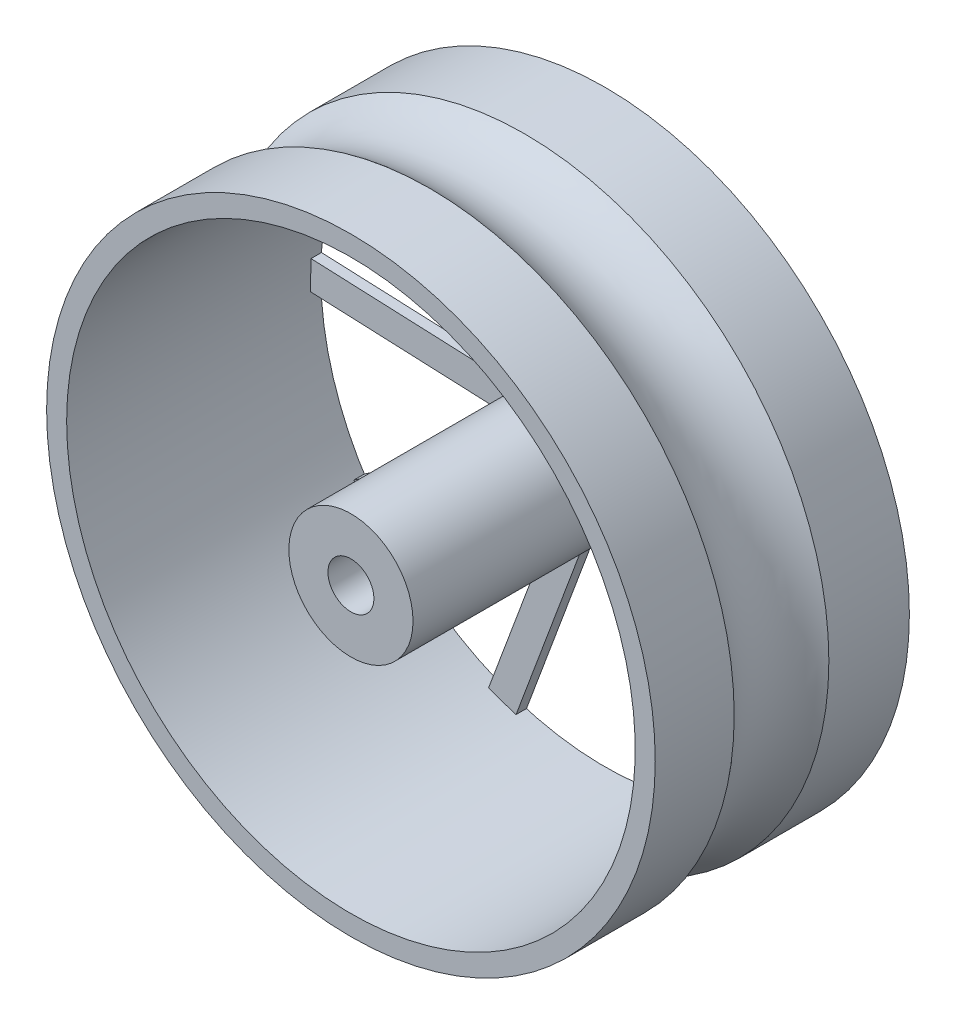
from build123d import *

# Parameters (mm, degrees)
SKETCH1_R             = 13.3223
SKETCH1_R_2           = 12.446
BOSS_EXTRUDE1_DEPTH   = 11.1252
SKETCH1_R_3           = 2.7178
SKETCH1_R_4           = 1.00584
BOSS_EXTRUDE1_2_DEPTH = 11.1252
BOSS_EXTRUDE2_DEPTH   = 0.4572
SKETCH5_R             = 3.187289882


with BuildPart() as part:
    # Sketch1 → Boss-Extrude1 (new body)
    with BuildSketch(Plane.XY):
        with Locations(Location((0, 0, 0), (0, 0, 180))):
            Circle(SKETCH1_R)
        with Locations(Location((0, 0, 0), (0, 0, 180))):
            Circle(SKETCH1_R_2, mode=Mode.SUBTRACT)
    extrude(amount=BOSS_EXTRUDE1_DEPTH)

    # Sketch5 → Cut-Revolve1 (revolve, cut)
    with BuildSketch(Plane(origin=(0, 0, 0), x_dir=(0, 0, -1), z_dir=(1, 0, 0)), mode=Mode.PRIVATE) as cut_revolve1_sk:
        with Locations((-5.597195997, 15.744244979)):
            Circle(SKETCH5_R)
    revolve(cut_revolve1_sk.sketch.rotate(Axis((0, 0, 11.606286755), (0, 0, -1)), 270), axis=Axis((0, 0, 11.606286755), (0, 0, -1)), mode=Mode.SUBTRACT)


with BuildPart() as body_2:
    # Sketch1 → Boss-Extrude1 2 (new body)
    with BuildSketch(Plane.XY):
        with Locations(Location((0, 0, 0), (0, 0, 180))):
            Circle(SKETCH1_R_3)
        with Locations(Location((0, 0, 0), (0, 0, 180))):
            Circle(SKETCH1_R_4, mode=Mode.SUBTRACT)
    extrude(amount=BOSS_EXTRUDE1_2_DEPTH)

    # Sketch2 → Boss-Extrude2 (add)
    with BuildSketch(Plane(origin=(0, 0, 0), x_dir=(-1, 0, 0), z_dir=(0, 0, -1))):
        with BuildLine():
            Line((0, 2.7178), (-3.442415798, 11.960463598))
            Line((-3.442415798, 11.960463598), (-4.643735623, 11.54723497))
            Line((-4.643735623, 11.54723497), (-1.243130148, 2.416829385))
            ThreePointArc((-1.243130148, 2.416829385), (-0.639522454, 2.641485921), (0, 2.7178))
        make_face()
        with BuildLine():
            ThreePointArc((-2.426290086, 1.224562477), (-2.070011002, 1.761105133), (-1.597482759, 2.198746387))
            Line((-1.597482759, 2.198746387), (-9.815156996, 7.652817073))
            Line((-9.815156996, 7.652817073), (-10.544155457, 6.612390014))
            Line((-10.544155457, 6.612390014), (-2.426290086, 1.224562477))
        make_face()
        with BuildLine():
            ThreePointArc((-2.682689677, -0.435445676), (-2.709825704, 0.208042043), (-2.5847814, 0.839846387))
            Line((-2.5847814, 0.839846387), (-12.438841826, 0.422054536))
            Line((-12.438841826, 0.422054536), (-12.417066289, -0.848163181))
            Line((-12.417066289, -0.848163181), (-2.682689677, -0.435445676))
        make_face()
        with BuildLine():
            ThreePointArc((-1.914392993, -1.929128381), (-2.314579091, -1.424486037), (-2.5847814, -0.839846387))
            Line((-2.5847814, -0.839846387), (-10.311311859, -6.969918489))
            Line((-10.311311859, -6.969918489), (-9.547079839, -7.984746868))
            Line((-9.547079839, -7.984746868), (-1.914392993, -1.929128381))
        make_face()
        with BuildLine():
            ThreePointArc((-0.414863253, -2.685949613), (-1.035241935, -2.512908868), (-1.597482759, -2.198746387))
            Line((-1.597482759, -2.198746387), (-4.245211231, -11.69961955))
            Line((-4.245211231, -11.69961955), (-3.030433384, -12.071428644))
            Line((-3.030433384, -12.071428644), (-0.414863253, -2.685949613))
        make_face()
        with BuildLine():
            Line((10.544155457, -6.612390014), (2.426290086, -1.224562477))
            ThreePointArc((2.426290086, -1.224562477), (2.070011002, -1.761105133), (1.597482759, -2.198746387))
            Line((1.597482759, -2.198746387), (9.815156996, -7.652817073))
            Line((9.815156996, -7.652817073), (10.544155457, -6.612390014))
        make_face()
        with BuildLine():
            Line((12.417066289, 0.848163181), (2.682689677, 0.435445676))
            ThreePointArc((2.682689677, 0.435445676), (2.709008199, 0.218429435), (2.7178, 0))
            ThreePointArc((2.7178, 0), (2.684339372, -0.425157589), (2.5847814, -0.839846387))
            Line((2.5847814, -0.839846387), (12.438841826, -0.422054536))
            Line((12.438841826, -0.422054536), (12.417066289, 0.848163181))
        make_face()
        with BuildLine():
            Line((9.547079839, 7.984746868), (1.914392993, 1.929128381))
            ThreePointArc((1.914392993, 1.929128381), (2.314579091, 1.424486037), (2.5847814, 0.839846387))
            Line((2.5847814, 0.839846387), (10.311311859, 6.969918489))
            Line((10.311311859, 6.969918489), (9.547079839, 7.984746868))
        make_face()
        with BuildLine():
            Line((2.892067949, 6.844120647), (1.243130148, 2.416829385))
            ThreePointArc((1.243130148, 2.416829385), (1.424486037, 2.314579091), (1.597482759, 2.198746387))
            Line((1.597482759, 2.198746387), (2.892067949, 6.844120647))
        make_face()
        with BuildLine():
            Line((3.437356932, 11.946880871), (1.683141062, 7.236924804))
            Line((1.683141062, 7.236924804), (0.414863253, 2.685949613))
            ThreePointArc((0.414863253, 2.685949613), (0.839846387, 2.5847814), (1.243130148, 2.416829385))
            Line((1.243130148, 2.416829385), (2.892067949, 6.844120647))
            Line((2.892067949, 6.844120647), (4.241320213, 11.685657366))
            Line((4.241320213, 11.685657366), (3.84157767, 11.823160351))
            Line((3.84157767, 11.823160351), (3.437356932, 11.946880871))
        make_face()
        with BuildLine():
            Line((1.683141062, 7.236924804), (0, 2.7178))
            ThreePointArc((0, 2.7178), (0.208042043, 2.709825704), (0.414863253, 2.685949613))
            Line((0.414863253, 2.685949613), (1.683141062, 7.236924804))
        make_face()
        Polygon((4.643735623, -11.54723497), (1.243130148, -2.416829385), (0, -2.712359299), (0, -2.7178), (3.442415798, -11.960463598), align=None)
    extrude(amount=-BOSS_EXTRUDE2_DEPTH)


solid = Compound([part.part, body_2.part])
